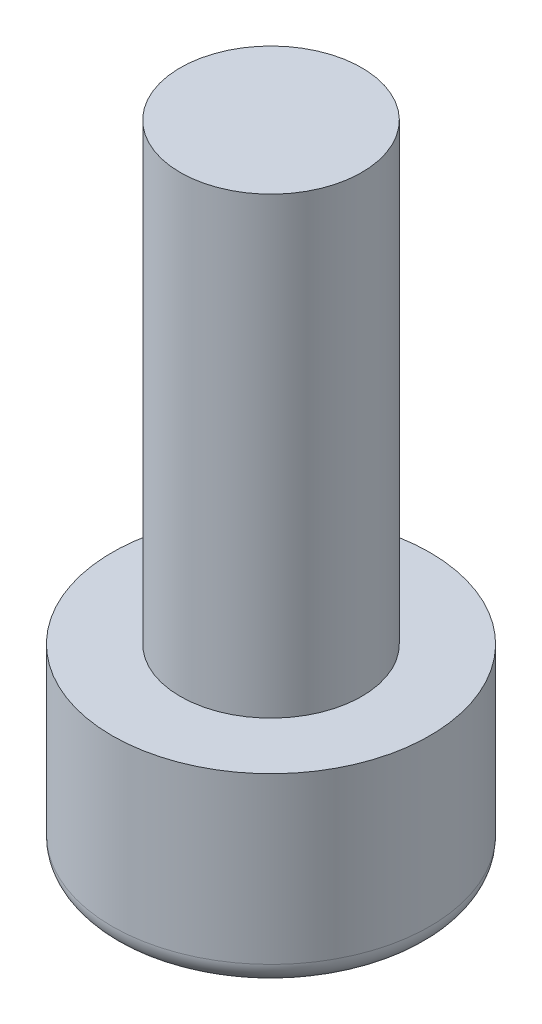
from build123d import *

# Parameters (mm, degrees)
SKETCH_1_R          = 3.5
EXTRUDE_1_DEPTH     = 4.14
SKETCH_2_R          = 2
EXTRUDE_2_DEPTH     = 10
FILLET_1_R          = 0.5
CUT_EXTRUDE_1_DEPTH = 2


with BuildPart() as part:
    # 草图1 → 凸台-拉伸1 (new body)
    with BuildSketch(Plane(origin=(0, 0, 0), x_dir=(1, 0, 0), z_dir=(0, 1, 0))):
        with Locations(Location((0, 0, 0), (0, 0, 270))):
            Circle(SKETCH_1_R)
    extrude(amount=EXTRUDE_1_DEPTH)

    # 草图2 → 凸台-拉伸2 (add)
    with BuildSketch(Plane(origin=(0, 4.14, 0), x_dir=(1, 0, 0), z_dir=(0, 1, 0))):
        with Locations(Location((0, 0, 0), (0, 0, 270))):
            Circle(SKETCH_2_R)
    extrude(amount=EXTRUDE_2_DEPTH)

    # 圆角1
    fillet_1_edges = [part.edges().sort_by_distance(p)[0] for p in [
        (0, 0, -3.5),
    ]]
    fillet(fillet_1_edges, radius=FILLET_1_R)

    # 草图3 → 切除-拉伸1 (cut)
    with BuildSketch(Plane.XZ):
        Polygon((1.698287208, 2.056072434), (-0.931467356, 2.498796082), (-2.629754564, 0.442723648), (-1.698287208, -2.056072434), (0.931467356, -2.498796082), (2.629754564, -0.442723648), align=None)
    extrude(amount=-CUT_EXTRUDE_1_DEPTH, mode=Mode.SUBTRACT)


solid = part.part
